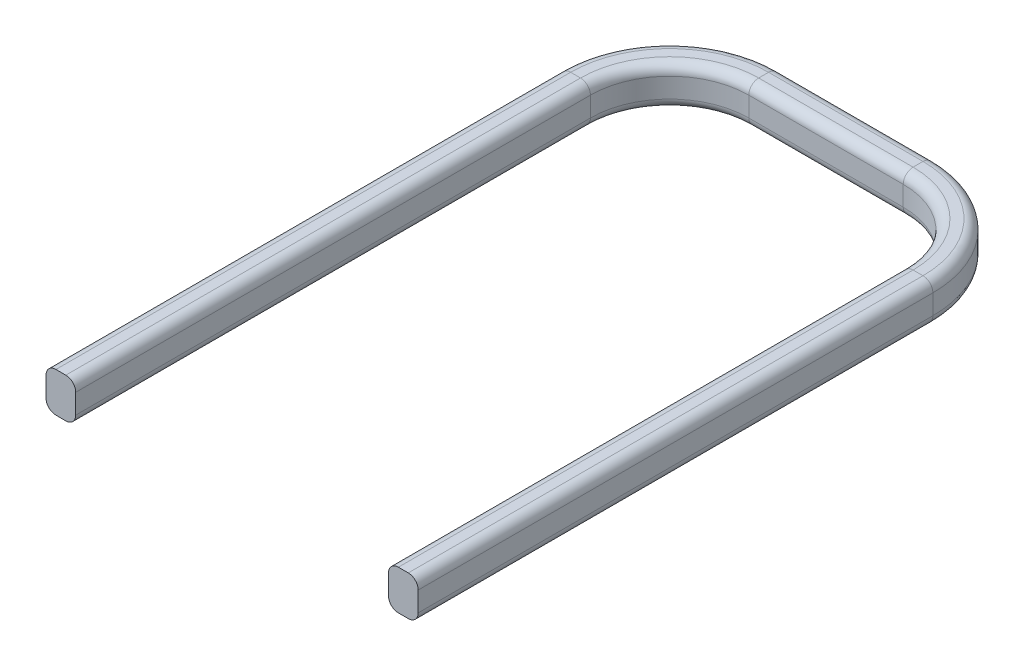
from build123d import *

# Parameters (mm, degrees)
SKETCH3_W = 0.75
SKETCH3_H = 1
FILLET1_R = 0.25


with BuildPart() as part:
    # Sweep1: sweep along a path in Sketch2
    with BuildLine(Plane(origin=(0, 0, 0), x_dir=(1, 0, 0), z_dir=(0, 1, 0))) as sweep1_path:
        Line((0, 0), (0, 13))
        ThreePointArc((0, 13), (0.585786438, 14.414213562), (2, 15))
        Line((2, 15), (5.9, 15))
        ThreePointArc((5.9, 15), (7.314213562, 14.414213562), (7.9, 13))
        Line((7.9, 13), (7.9, 0))
    # Sketch3 → Sweep1 (sweep)
    with BuildSketch(Plane.XY):
        with Locations((-0.375, 0.5)):
            Rectangle(SKETCH3_W, SKETCH3_H)
    sweep(path=sweep1_path.line)

    # Fillet1
    fillet1_edges = [part.edges().sort_by_distance(p)[0] for p in [
        (0, 1, -6.5),
        (-0.75, 1, -6.5),
        (-0.75, 0, -6.5),
        (7.9, 0, -6.5),
        (7.9, 1, -6.5),
        (8.65, 1, -6.5),
        (8.65, 0, -6.5),
        (7.314213562, 0, -14.414213562),
        (7.314213562, 1, -14.414213562),
        (7.844543648, 1, -14.944543648),
        (7.844543648, 0, -14.944543648),
        (3.95, 0, -15),
        (3.95, 1, -15),
        (3.95, 1, -15.75),
        (3.95, 0, -15.75),
        (0.585786438, 0, -14.414213562),
        (0.585786438, 1, -14.414213562),
        (0.055456352, 1, -14.944543648),
        (0.055456352, 0, -14.944543648),
        (0, 0, -6.5),
    ]]
    fillet(fillet1_edges, radius=FILLET1_R)


solid = part.part
